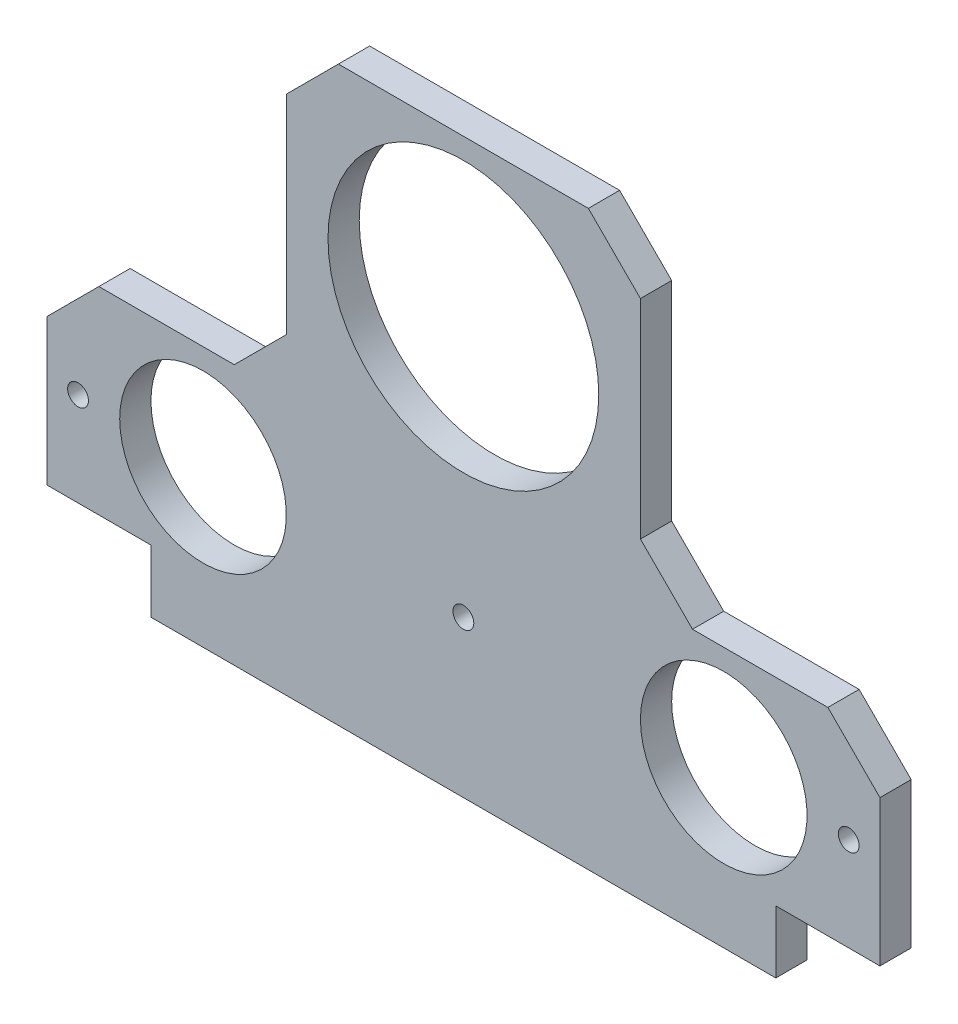
from build123d import *

# Parameters (mm, degrees)
ESQUISSE1_R             = 13
BOSS_EXTRU_1_DEPTH      = 12
BOSS_EXTRU_2_START      = -12
ESQUISSE2_R             = 13
ESQUISSE2_R_2           = 5.5
BOSS_EXTRU_2_DEPTH      = 3
ESQUISSE4_R             = 8
ENL_V_MAT_EXTRU_2_DEPTH = 6
ESQUISSE5_R             = 3
ENL_V_MAT_EXTRU_3_DEPTH = 69.271516755
ENL_V_START             = -12
ESQUISSE6_W             = 10
ESQUISSE6_H             = 6
ENL_V_MAT_EXTRU_4_DEPTH = 12
CHANFREIN1_SIZE         = 5
ESQUISSE7_R             = 1
ENL_V_MAT_EXTRU_5_DEPTH = 12
ESQUISSE8_W             = 80
ESQUISSE8_H             = 3
ESQUISSE8_H_2           = 6
ENL_V_MAT_EXTRU_6_DEPTH = 70.057946682


with BuildPart() as part:
    # Esquisse1 → Boss.-Extru.1 (new body)
    with BuildSketch(Plane.XY):
        Polygon((-40, 0), (40, 0), (40, 25), (17, 25), (17, 55), (-17, 55), (-17, 25), (-40, 25), align=None)
        with Locations((0, 40)):
            Circle(ESQUISSE1_R, mode=Mode.SUBTRACT)
    extrude(amount=BOSS_EXTRU_1_DEPTH)

    # Esquisse2 → Boss.-Extru.2 (add)
    with BuildSketch(Plane.XY.offset(12).offset(BOSS_EXTRU_2_START)):
        with Locations((0, 40)):
            Circle(ESQUISSE2_R)
        with Locations((0, 40)):
            Circle(ESQUISSE2_R_2, mode=Mode.SUBTRACT)
    extrude(amount=BOSS_EXTRU_2_DEPTH)

    # Esquisse4 → Enlèv. mat.-Extru.2 (cut)
    with BuildSketch(Plane(origin=(0, 0, 0), x_dir=(-1, 0, 0), z_dir=(0, 0, -1))):
        with Locations((-25, 15)):
            Circle(ESQUISSE4_R)
        with Locations(Location((25, 15, 0), (0, 0, 180))):
            Circle(ESQUISSE4_R)
    extrude(amount=-ENL_V_MAT_EXTRU_2_DEPTH, mode=Mode.SUBTRACT)

    # Esquisse5 → Enlèv. mat.-Extru.3 (cut, through all)
    with BuildSketch(Plane(origin=(0, 0, 6), x_dir=(-1, 0, 0), z_dir=(0, 0, -1))):
        with Locations((-25, 15)):
            Circle(ESQUISSE5_R)
        with Locations(Location((25, 15, 0), (0, 0, 180))):
            Circle(ESQUISSE5_R)
    extrude(amount=-ENL_V_MAT_EXTRU_3_DEPTH, mode=Mode.SUBTRACT)

    # Esquisse6 → Enlèv. mat.-Extru.4 (cut)
    with BuildSketch(Plane.XY.offset(12).offset(ENL_V_START)):
        with Locations((35, 3)):
            Rectangle(ESQUISSE6_W, ESQUISSE6_H)
        with Locations((-35, 3)):
            Rectangle(ESQUISSE6_W, ESQUISSE6_H)
    extrude(amount=ENL_V_MAT_EXTRU_4_DEPTH, mode=Mode.SUBTRACT)

    # Chanfrein1
    chanfrein1_edges = [part.edges().sort_by_distance(p)[0] for p in [
        (-17, 55, 6),
        (17, 55, 6),
        (17, 25, 6),
        (40, 25, 6),
        (-40, 25, 6),
        (-17, 25, 6),
    ]]
    chamfer(chanfrein1_edges, length=CHANFREIN1_SIZE)

    # Esquisse7 → Enlèv. mat.-Extru.5 (cut)
    with BuildSketch(Plane(origin=(0, 0, 0), x_dir=(-1, 0, 0), z_dir=(0, 0, -1))):
        with Locations((-10, 45)):
            Circle(ESQUISSE7_R)
        with Locations(Location((10, 45, 0), (0, 0, 180))):
            Circle(ESQUISSE7_R)
        with Locations((-37, 15)):
            Circle(ESQUISSE7_R)
        with Locations(Location((37, 15, 0), (0, 0, 180))):
            Circle(ESQUISSE7_R)
        with Locations((0, 15)):
            Circle(ESQUISSE7_R)
    extrude(amount=-ENL_V_MAT_EXTRU_5_DEPTH, mode=Mode.SUBTRACT)

    # Esquisse8 → Enlèv. mat.-Extru.6 (cut, through all)
    with BuildSketch(Plane(origin=(0, 55, 0), x_dir=(1, 0, 0), z_dir=(0, 1, 0))):
        with Locations((0, -1.5)):
            Rectangle(ESQUISSE8_W, ESQUISSE8_H)
        with Locations((0, -9)):
            Rectangle(ESQUISSE8_W, ESQUISSE8_H_2)
    extrude(amount=-ENL_V_MAT_EXTRU_6_DEPTH, mode=Mode.SUBTRACT)


solid = part.part
